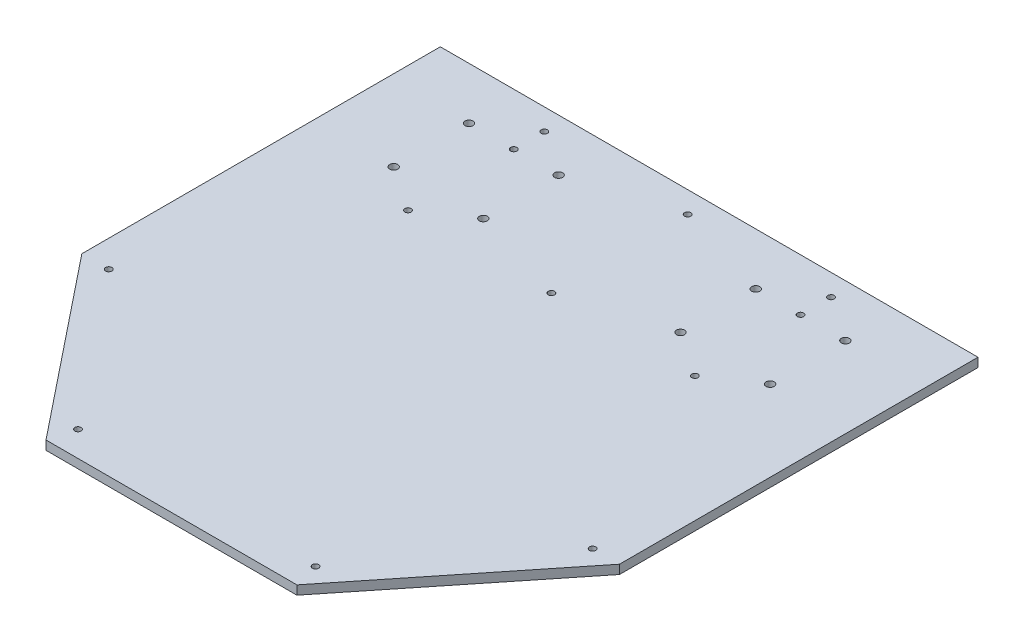
from build123d import *

# Parameters (mm, degrees)
SKETCH_2_R          = 2.25
EXTRUDE_2_DEPTH     = 5
SKETCH_5_R          = 1.75
CUT_EXTRUDE_3_DEPTH = 213.190951739
SKETCH_8_R          = 1.75
CUT_EXTRUDE_5_DEPTH = 213.190951739


with BuildPart() as part:
    # 草圖2 → 填料-伸長2 (new body)
    with BuildSketch(Plane(origin=(0, 0, 0), x_dir=(1, 0, 0), z_dir=(0, 1, 0))):
        Polygon((-150, 150), (150, 150), (150, -50), (70, -150), (-70, -150), (-150, -50), align=None)
        with Locations(Location((-105, 121, 0), (0, 0, 270))):
            Circle(SKETCH_2_R, mode=Mode.SUBTRACT)
        with Locations(Location((-105, 79, 0), (0, 0, 270))):
            Circle(SKETCH_2_R, mode=Mode.SUBTRACT)
        with Locations(Location((-55, 79, 0), (0, 0, 270))):
            Circle(SKETCH_2_R, mode=Mode.SUBTRACT)
        with Locations(Location((-55, 121, 0), (0, 0, 270))):
            Circle(SKETCH_2_R, mode=Mode.SUBTRACT)
        with Locations(Location((55, 121, 0), (0, 0, 270))):
            Circle(SKETCH_2_R, mode=Mode.SUBTRACT)
        with Locations(Location((55, 79, 0), (0, 0, 270))):
            Circle(SKETCH_2_R, mode=Mode.SUBTRACT)
        with Locations(Location((105, 121, 0), (0, 0, 270))):
            Circle(SKETCH_2_R, mode=Mode.SUBTRACT)
        with Locations(Location((105, 79, 0), (0, 0, 270))):
            Circle(SKETCH_2_R, mode=Mode.SUBTRACT)
    extrude(amount=EXTRUDE_2_DEPTH)

    # 草圖5 → 除料-伸長3 (cut, through all)
    with BuildSketch(Plane(origin=(0, 5, 0), x_dir=(1, 0, 0), z_dir=(0, 1, 0))):
        with Locations(Location((0, 62, 0), (0, 0, 270))):
            Circle(SKETCH_5_R)
        with Locations(Location((-80, 62, 0), (0, 0, 270))):
            Circle(SKETCH_5_R)
        with Locations(Location((80, 62, 0), (0, 0, 90))):
            Circle(SKETCH_5_R)
        with Locations(Location((80, 138, 0), (0, 0, 270))):
            Circle(SKETCH_5_R)
        with Locations(Location((-80, 138, 0), (0, 0, 90))):
            Circle(SKETCH_5_R)
        with Locations(Location((0, 138, 0), (0, 0, 90))):
            Circle(SKETCH_5_R)
    extrude(amount=-CUT_EXTRUDE_3_DEPTH, mode=Mode.SUBTRACT)

    # 草圖8 → 除料-伸長5 (cut, through all)
    with BuildSketch(Plane(origin=(0, 5, 0), x_dir=(1, 0, 0), z_dir=(0, 1, 0))):
        with Locations(Location((-80, 121, 0), (0, 0, 270))):
            Circle(SKETCH_8_R)
        with Locations(Location((80, 121, 0), (0, 0, 90))):
            Circle(SKETCH_8_R)
        with Locations(Location((-135, -50, 0), (0, 0, 270))):
            Circle(SKETCH_8_R)
        with Locations(Location((-66.283544769, -135.895569039, 0), (0, 0, 270))):
            Circle(SKETCH_8_R)
        with Locations(Location((135, -50, 0), (0, 0, 90))):
            Circle(SKETCH_8_R)
        with Locations(Location((66.283544769, -135.895569039, 0), (0, 0, 90))):
            Circle(SKETCH_8_R)
    extrude(amount=-CUT_EXTRUDE_5_DEPTH, mode=Mode.SUBTRACT)


solid = part.part
